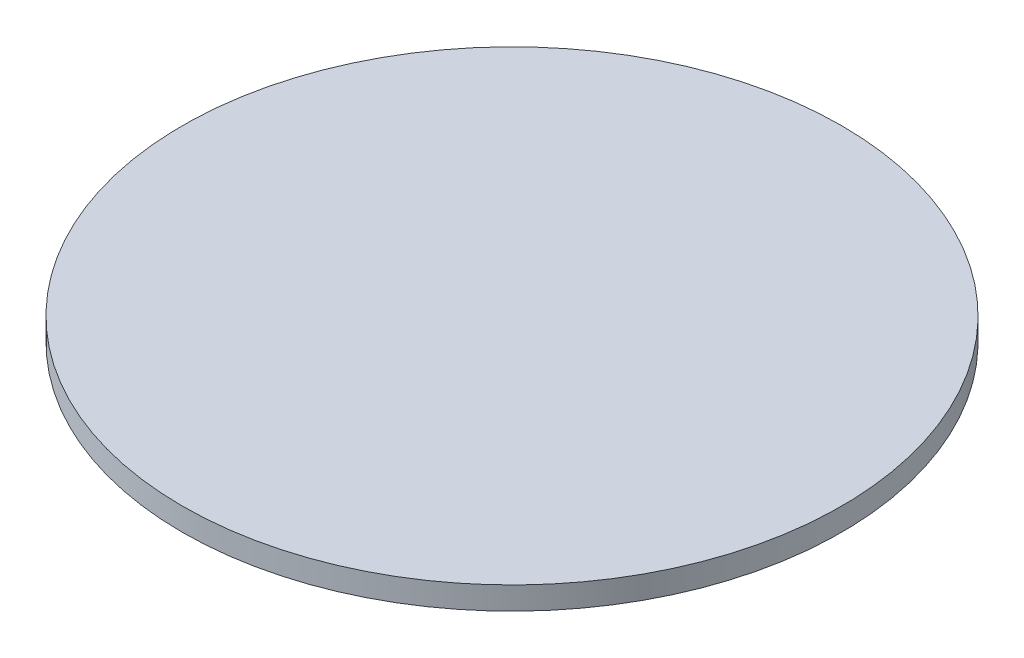
from build123d import *

# Parameters (mm, degrees)
SKETCH1_R           = 29
BOSS_EXTRUDE1_DEPTH = 2


with BuildPart() as part:
    # Sketch1 → Boss-Extrude1 (new body)
    with BuildSketch(Plane(origin=(0, 0, 0), x_dir=(1, 0, 0), z_dir=(0, 1, 0))):
        with Locations(Location((0, 0, 0), (0, 0, 270))):
            Circle(SKETCH1_R)
    extrude(amount=BOSS_EXTRUDE1_DEPTH)


solid = part.part
